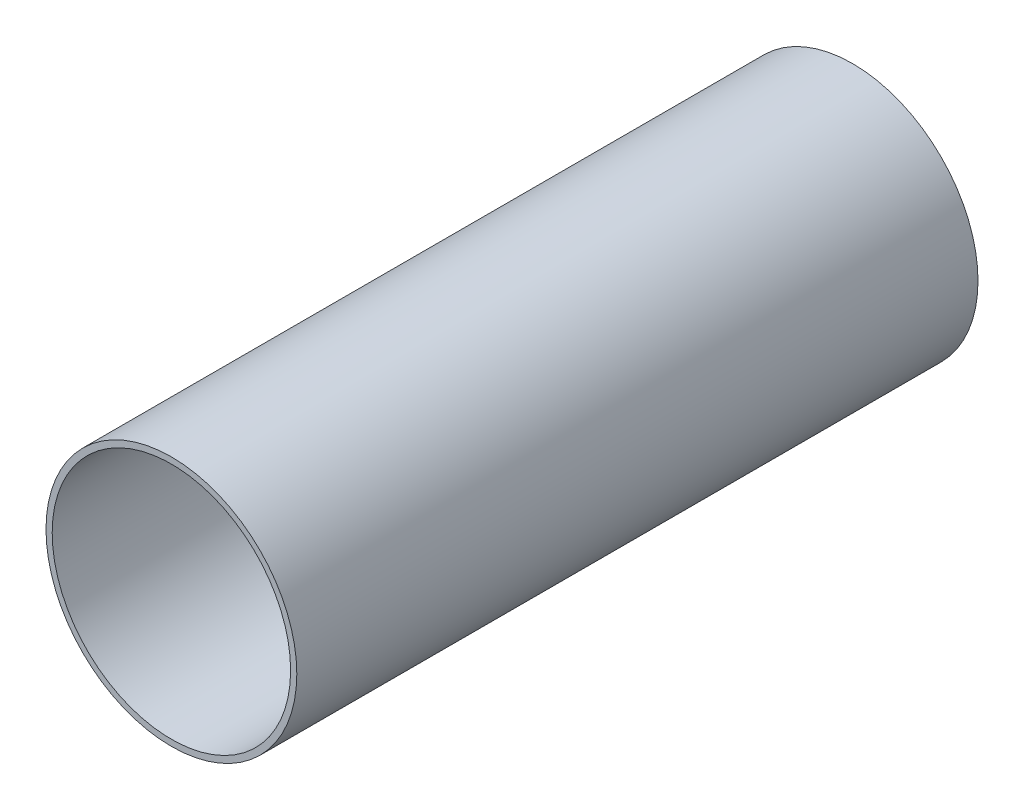
from build123d import *

# Parameters (mm, degrees)
SKETCH1_R           = 20.25
SKETCH1_R_2         = 19.25
BOSS_EXTRUDE1_DEPTH = 110


with BuildPart() as part:
    # Sketch1 → Boss-Extrude1 (new body)
    with BuildSketch(Plane.XY):
        Circle(SKETCH1_R)
        Circle(SKETCH1_R_2, mode=Mode.SUBTRACT)
    extrude(amount=BOSS_EXTRUDE1_DEPTH)


solid = part.part
